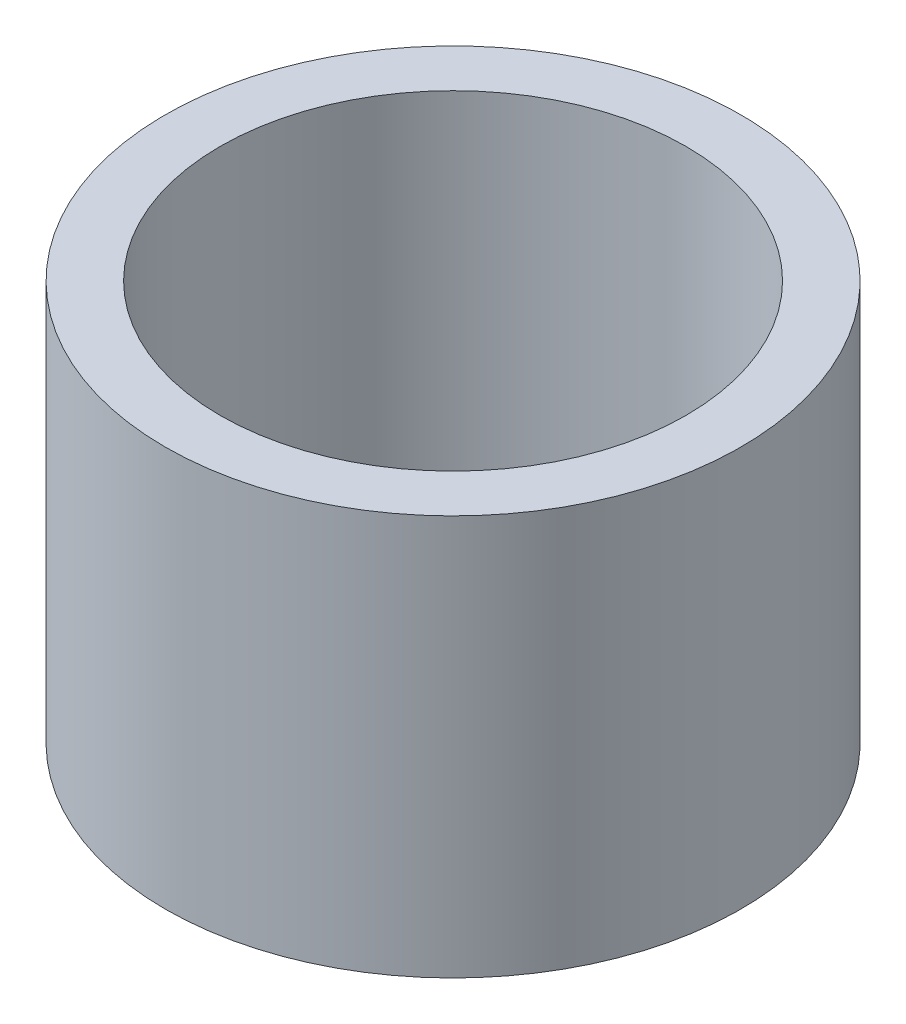
from build123d import *

# Parameters (mm, degrees)
SKETCH1_R           = 10.5
BOSS_EXTRUDE1_DEPTH = 14.6
SKETCH2_R           = 8.5
CUT_EXTRUDE1_DEPTH  = 21.824504796


with BuildPart() as part:
    # Sketch1 → Boss-Extrude1 (new body)
    with BuildSketch(Plane(origin=(0, 0, 0), x_dir=(1, 0, 0), z_dir=(0, 1, 0))):
        with Locations(Location((0, 0, 0), (0, 0, 270))):
            Circle(SKETCH1_R)
    extrude(amount=BOSS_EXTRUDE1_DEPTH)

    # Sketch2 → Cut-Extrude1 (cut, through all)
    with BuildSketch(Plane(origin=(0, 14.6, 0), x_dir=(1, 0, 0), z_dir=(0, 1, 0))):
        with Locations(Location((0, 0, 0), (0, 0, 270))):
            Circle(SKETCH2_R)
    extrude(amount=-CUT_EXTRUDE1_DEPTH, mode=Mode.SUBTRACT)


solid = part.part
